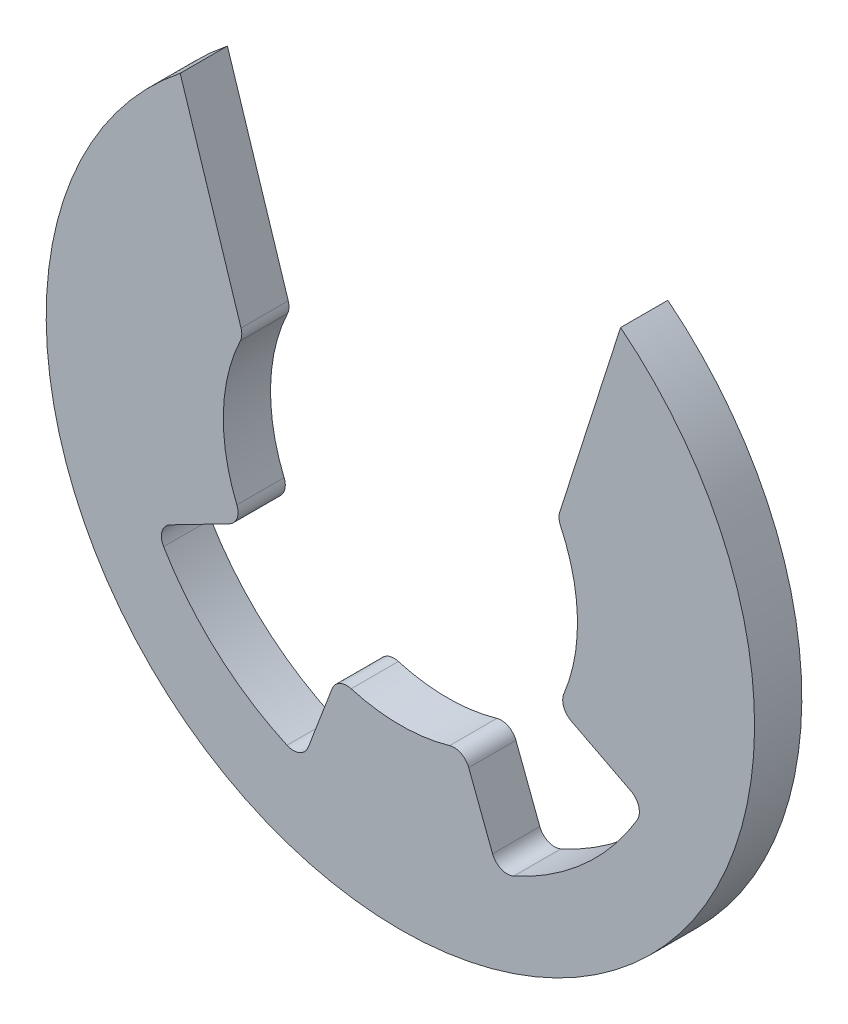
from build123d import *

# Parameters (mm, degrees)
BOSS_EXTRUDE1_DEPTH = 0.6


with BuildPart() as part:
    # Sketch1 → Boss-Extrude1 (new body)
    with BuildSketch(Plane.XY):
        with BuildLine():
            Line((2.7975505, 3.524728529), (2.024608864, 1.107728687))
            ThreePointArc((2.024608864, 1.107728687), (2.015540231, 1.033623325), (2.034280186, 0.961355359))
            ThreePointArc((2.034280186, 0.961355359), (2.249370488, 0.053220369), (2.077469984, -0.864070869))
            ThreePointArc((2.077469984, -0.864070869), (2.074285356, -1.009527687), (2.170509413, -1.118654946))
            Line((2.170509413, -1.118654946), (2.927941172, -1.50902634))
            ThreePointArc((2.927941172, -1.50902634), (3.02857216, -1.63168787), (3.008214578, -1.78903467))
            ThreePointArc((3.008214578, -1.78903467), (2.331985815, -2.609950605), (1.440417044, -3.189858734))
            ThreePointArc((1.440417044, -3.189858734), (1.281779829, -3.192443437), (1.171176469, -3.078692203))
            Line((1.171176469, -3.078692203), (0.868203765, -2.282262523))
            ThreePointArc((0.868203765, -2.282262523), (0.770555129, -2.174408123), (0.625658635, -2.1612615))
            ThreePointArc((0.625658635, -2.1612615), (0, -2.25), (-0.625658635, -2.1612615))
            ThreePointArc((-0.625658635, -2.1612615), (-0.770555129, -2.174408123), (-0.868203765, -2.282262523))
            Line((-0.868203765, -2.282262523), (-1.171176469, -3.078692203))
            ThreePointArc((-1.171176469, -3.078692203), (-1.281779829, -3.192443437), (-1.440417044, -3.189858734))
            ThreePointArc((-1.440417044, -3.189858734), (-2.331985815, -2.609950605), (-3.008214578, -1.78903467))
            ThreePointArc((-3.008214578, -1.78903467), (-3.02857216, -1.63168787), (-2.927941172, -1.50902634))
            Line((-2.927941172, -1.50902634), (-2.170509413, -1.118654946))
            ThreePointArc((-2.170509413, -1.118654946), (-2.074285356, -1.009527687), (-2.077469984, -0.864070869))
            ThreePointArc((-2.077469984, -0.864070869), (-2.249370488, 0.053220369), (-2.034280186, 0.961355359))
            ThreePointArc((-2.034280186, 0.961355359), (-2.015540231, 1.033623325), (-2.024608864, 1.107728687))
            Line((-2.024608864, 1.107728687), (-2.7975505, 3.524728529))
            ThreePointArc((-2.7975505, 3.524728529), (0, -4.5), (2.7975505, 3.524728529))
        make_face()
    extrude(amount=BOSS_EXTRUDE1_DEPTH)


solid = part.part
